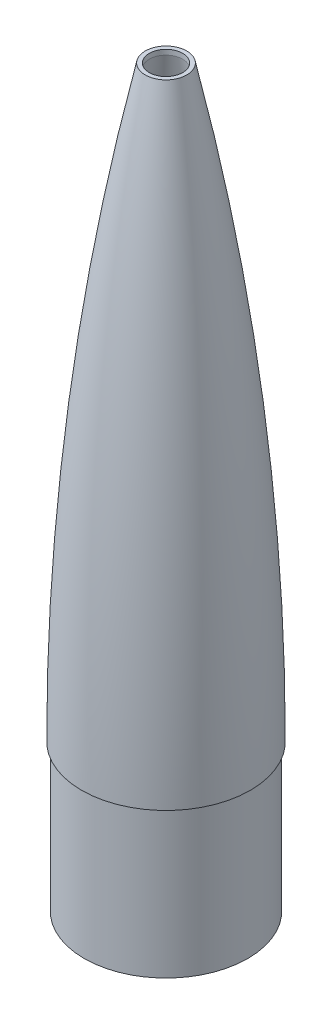
from build123d import *


with BuildPart() as part:
    # Sketch2 → Revolve1 (revolve)
    with BuildSketch(Plane.XY, mode=Mode.PRIVATE) as revolve1_sk:
        with BuildLine():
            Line((46.482, 0), (46.482, 91.948))
            Line((46.482, 91.948), (48.003200413, 91.948))
            ThreePointArc((48.003200413, 91.948), (38.343372168, 267.70619245), (10.118403547, 441.452))
            Line((10.118403547, 441.452), (10.118403547, 444.5))
            Line((10.118403547, 444.5), (12.573, 444.5))
            ThreePointArc((12.573, 444.5), (41.405749629, 267.738018442), (51.054, 88.9))
            Line((51.054, 88.9), (49.53, 88.9))
            Line((49.53, 88.9), (49.53, 0))
            Line((49.53, 0), (46.482, 0))
        make_face()
    revolve(revolve1_sk.sketch.rotate(Axis((0, 0, 0), (0, 1, 0)), 90), axis=Axis((0, 0, 0), (0, 1, 0)))


solid = part.part
